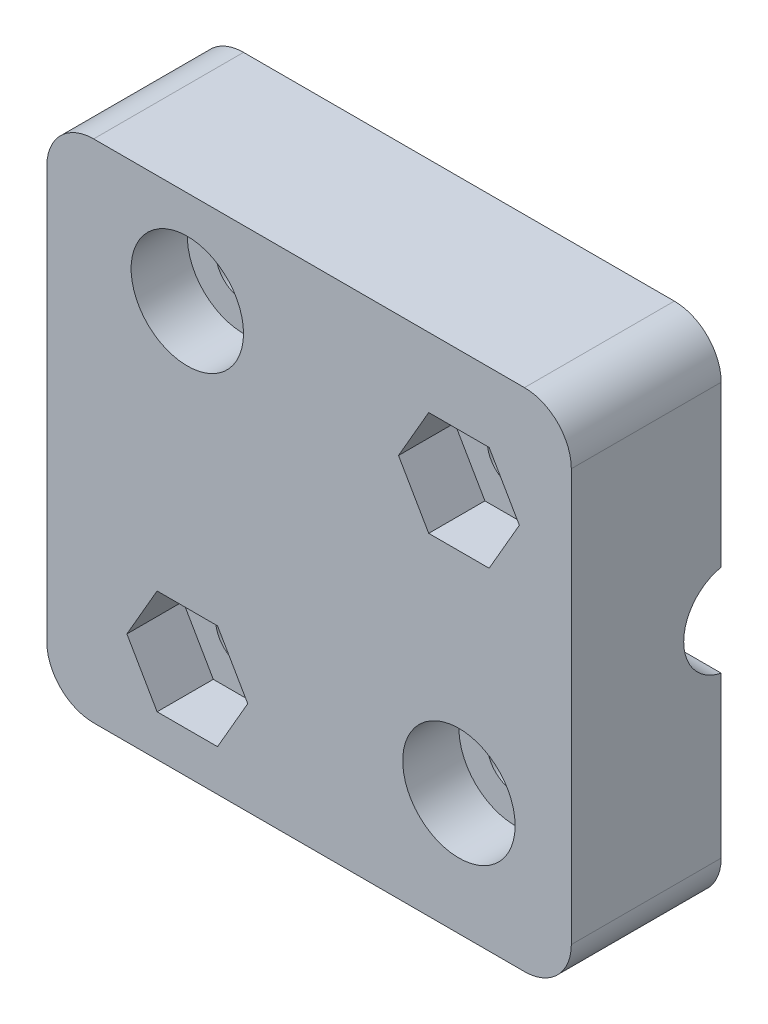
from build123d import *

# Parameters (mm, degrees)
SKETCH1_W           = 28
SKETCH1_H           = 27
BOSS_EXTRUDE1_DEPTH = 8
SKETCH2_R           = 1.48371595
CUT_EXTRUDE1_DEPTH  = 22.029740845
SKETCH3_R           = 3
CUT_EXTRUDE2_DEPTH  = 3
FILLET1_R           = 2.5
SKETCH4_R           = 2.5
CUT_EXTRUDE3_DEPTH  = 11.5
SKETCH5_R           = 4
CUT_EXTRUDE4_DEPTH  = 14


with BuildPart() as part:
    # Sketch1 → Boss-Extrude1 (new body)
    with BuildSketch(Plane.XY):
        Rectangle(SKETCH1_W, SKETCH1_H)
    extrude(amount=BOSS_EXTRUDE1_DEPTH)

    # Sketch2 → Cut-Extrude1 (cut, through all)
    with BuildSketch(Plane.XY.offset(8)):
        with Locations((-6.5, 8.5)):
            Circle(SKETCH2_R)
        with Locations((-6.5, -8.5)):
            Circle(SKETCH2_R)
        with Locations((8, -7)):
            Circle(SKETCH2_R)
        with Locations((8, 7)):
            Circle(SKETCH2_R)
    extrude(amount=-CUT_EXTRUDE1_DEPTH, mode=Mode.SUBTRACT)

    # Sketch3 → Cut-Extrude2 (cut)
    with BuildSketch(Plane.XY.offset(8)):
        with Locations((-6.5, 8.5)):
            Circle(SKETCH3_R)
        with Locations((8, -7)):
            Circle(SKETCH3_R)
        Polygon((-8.112712507, -11.2933), (-4.887287493, -11.2933), (-3.274574986, -8.5), (-4.887287493, -5.7067), (-8.112712507, -5.7067), (-9.725425014, -8.5), align=None)
        Polygon((6.387287493, 4.2067), (9.612712507, 4.2067), (11.225425014, 7), (9.612712507, 9.7933), (6.387287493, 9.7933), (4.774574986, 7), align=None)
    extrude(amount=-CUT_EXTRUDE2_DEPTH, mode=Mode.SUBTRACT)

    # Fillet1
    fillet1_edges = [part.edges().sort_by_distance(p)[0] for p in [
        (-14, 13.5, 4),
        (14, 13.5, 4),
        (14, -13.5, 4),
        (-14, -13.5, 4),
    ]]
    fillet(fillet1_edges, radius=FILLET1_R)

    # Sketch4 → Cut-Extrude3 (cut)
    with BuildSketch(Plane(origin=(14, 0, 0), x_dir=(0, 0, -1), z_dir=(1, 0, 0))):
        with Locations((0.5, 0)):
            Circle(SKETCH4_R)
    extrude(amount=-CUT_EXTRUDE3_DEPTH, mode=Mode.SUBTRACT)

    # Sketch5 → Cut-Extrude4 (cut)
    with BuildSketch(Plane.ZY.offset(14)):
        with Locations((-0.5, 0)):
            Circle(SKETCH5_R)
    extrude(amount=-CUT_EXTRUDE4_DEPTH, mode=Mode.SUBTRACT)


solid = part.part
